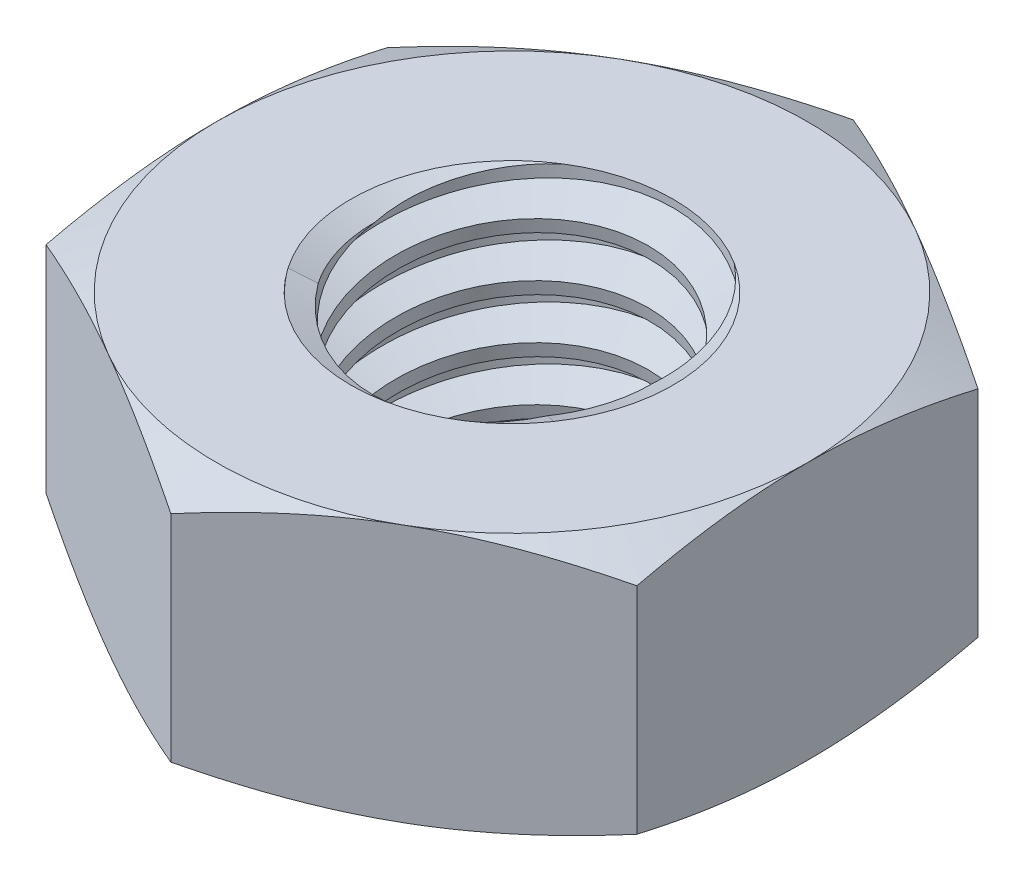
from build123d import *

# Parameters (mm, degrees)
EXTRUDE1_DEPTH      = 1.2
SKETCH2_W           = 1.5
SKETCH2_H           = 2.4
LPATTERN1_COUNT     = 5
LPATTERN1_PITCH     = 0.5
LPATTERN1_COL_COUNT = 2
LPATTERN1_COL_PITCH = 0.5


with BuildPart() as part:
    # Sketch1 → Extrude1 (new, symmetric)
    with BuildSketch(Plane(origin=(0, 0, 0), x_dir=(1, 0, 0), z_dir=(0, 1, 0))):
        Polygon((0, 3.175426481), (-2.75, 1.58771324), (-2.75, -1.58771324), (0, -3.175426481), (2.75, -1.58771324), (2.75, 1.58771324), align=None)
    extrude(amount=EXTRUDE1_DEPTH, both=True)

    # Sketch4 → Cut-Revolve2 (revolve, cut)
    with BuildSketch(Plane(origin=(0, 0, 0), x_dir=(0, 0, -1), z_dir=(1, 0, 0))):
        Polygon((0, 1.2), (1.5, 1.2), (1.269011592, 1.092288336), (1.269011592, -1.092288336), (1.5, -1.2), (0, -1.2), align=None)
    revolve(axis=Axis((0, 1.2, 0), (0, 1, 0)), mode=Mode.SUBTRACT)


with BuildPart() as body_2:
    # Sketch2 → Revolve1 (revolve)
    with BuildSketch(Plane(origin=(0, 0, 0), x_dir=(0, 0, -1), z_dir=(1, 0, 0))):
        with Locations((0.75, 0)):
            Rectangle(SKETCH2_W, SKETCH2_H)
    revolve(axis=Axis((0, -2.7, 0), (0, 1, 0)))

    # Sketch3 → Cut-Revolve1 (revolve, cut)
    with BuildSketch(Plane(origin=(0, 0, 0), x_dir=(0, 0, -1), z_dir=(1, 0, 0)), mode=Mode.PRIVATE) as cut_revolve1_sk:
        Polygon((1.510274937, 1.13835038), (1.582199494, 0.706803038), (1.289561466, 0.816435308), (1.269011592, 0.939734548), align=None)
    cut_revolve1 = revolve(cut_revolve1_sk.sketch.rotate(Axis((0, 1.2, 0.089188249), (0, -0.9863939238321437, -0.1643989873053576)), 180), axis=Axis((0, 1.2, 0.089188249), (0, -0.9863939238321437, -0.1643989873053576)), mode=Mode.SUBTRACT)

    # LPattern1: Cut-Revolve1 ×5
    with Locations(*[(0, -i * LPATTERN1_PITCH, 0) for i in range(1, LPATTERN1_COUNT)]):
        add(cut_revolve1, mode=Mode.SUBTRACT)

    # LPattern1 col: Cut-Revolve1 ×2
    with Locations(*[(0, i * LPATTERN1_COL_PITCH, 0) for i in range(1, LPATTERN1_COL_COUNT)]):
        add(cut_revolve1, mode=Mode.SUBTRACT)


with BuildPart() as part_1:
    add(part.part)

    # Combine1: cut body 2
    add(body_2.part, mode=Mode.SUBTRACT)

    # Sketch5 → Cut-Revolve3 (revolve, cut)
    with BuildSketch(Plane(origin=(0, 0, 0), x_dir=(0, 0, -1), z_dir=(1, 0, 0)), mode=Mode.PRIVATE) as cut_revolve3_sk:
        Polygon((0, -1.2), (2.75, -1.2), (3.175426481, -1.001620374), (3.175426481, 1.001620374), (2.75, 1.2), (0, 1.2), (0, 2.47), (4.445426481, 2.47), (4.445426481, -2.47), (0, -2.47), align=None)
    revolve(cut_revolve3_sk.sketch.rotate(Axis((0, -1.2, 0), (0, 1, 0)), 55.157981045), axis=Axis((0, -1.2, 0), (0, 1, 0)), mode=Mode.SUBTRACT)


solid = part_1.part
